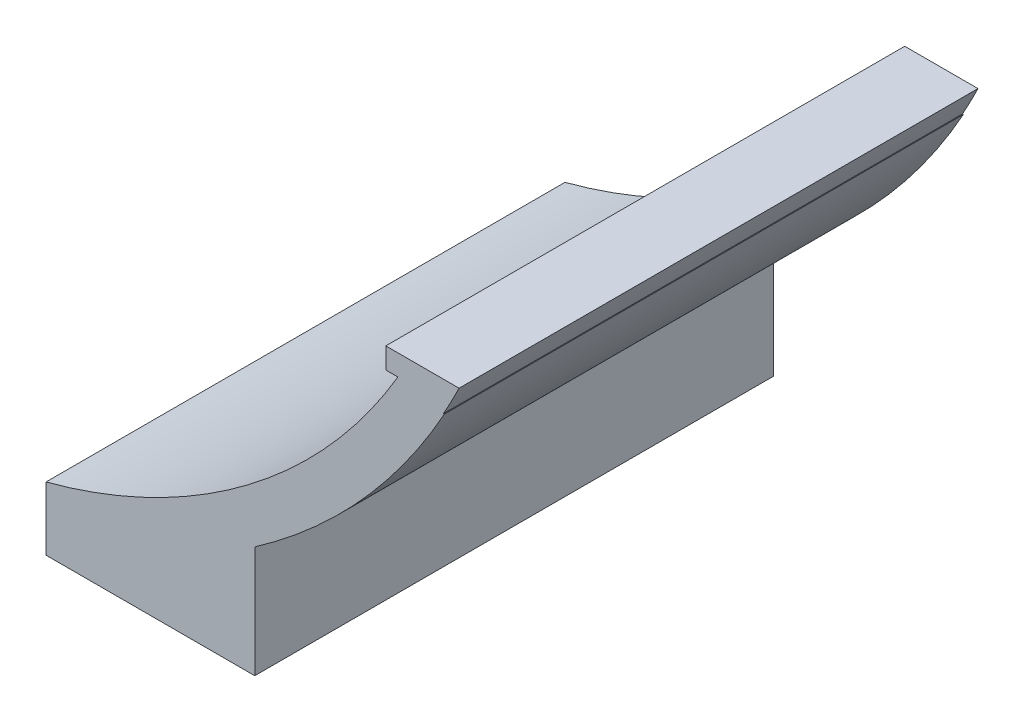
from build123d import *

# Parameters (mm, degrees)
SKETCH_1_R          = 210
SKETCH_1_R_2        = 203
EXTRUDE_2_DEPTH     = 174
EXTRUDE_START       = -174
EXTRUDE_4_DEPTH     = 174
CUT_EXTRUDE_1_DEPTH = 654
EXTRUDE_5_DEPTH     = 174
EXTRUDE_6_DEPTH     = 174
EXTRUDE_7_DEPTH     = 174
EXTRUDE_8_DEPTH     = 174
CUT_EXTRUDE_START   = -654
CUT_EXTRUDE_2_DEPTH = 654
SKETCH_10_W         = 20.487801248
SKETCH_10_H         = 174
CUT_EXTRUDE_3_DEPTH = 327
SKETCH_11_W         = 235.63772895
SKETCH_11_H         = 249.192111589
CUT_EXTRUDE_4_DEPTH = 238


with BuildPart() as part:
    # 草图1 → 凸台-拉伸2 (new body)
    with BuildSketch(Plane.XY):
        Circle(SKETCH_1_R)
        Circle(SKETCH_1_R_2, mode=Mode.SUBTRACT)
    extrude(amount=EXTRUDE_2_DEPTH)

    # 草图2 → 凸台-拉伸4 (add)
    with BuildSketch(Plane.XY.offset(174).offset(EXTRUDE_START)):
        with BuildLine():
            Line((-170.735431044, -102), (-173.735431044, -102))
            Line((-173.735431044, -102), (-175.513532242, -102))
            ThreePointArc((-175.513532242, -102), (-174.63092392, -103.50381834), (-173.735431044, -105))
            Line((-173.735431044, -105), (-170.735431044, -105))
            Line((-170.735431044, -105), (-170.735431044, -102))
        make_face()
        with BuildLine():
            ThreePointArc((173.735431044, -105), (174.63092392, -103.50381834), (175.513532242, -102))
            Line((175.513532242, -102), (173.735431044, -102))
            Line((173.735431044, -102), (170.735431044, -102))
            Line((170.735431044, -102), (170.735431044, -105))
            Line((170.735431044, -105), (173.735431044, -105))
        make_face()
    extrude(amount=EXTRUDE_4_DEPTH)

    # 草图3 → 切除-拉伸1 (cut)
    with BuildSketch(Plane.XY.offset(174)):
        Polygon((-170.735431044, -102), (238.333646515, -102), (254.334169784, 272.292523591), (-334.569415043, 221.85110305), (-306.830562533, -102), align=None)
    extrude(amount=-CUT_EXTRUDE_1_DEPTH, mode=Mode.SUBTRACT)

    # 草图5 → 凸台-拉伸5 (add)
    with BuildSketch(Plane.XY.offset(174).offset(EXTRUDE_START)):
        with BuildLine():
            Line((-120, -209.75), (-10.243900624, -209.75))
            ThreePointArc((-10.243900624, -209.75), (-67.755470707, -198.769203322), (-120, -172.336879396))
            Line((-120, -172.336879396), (-120, -209.75))
        make_face()
        with BuildLine():
            ThreePointArc((120, -172.336879396), (67.755470707, -198.769203322), (10.243900624, -209.75))
            Line((10.243900624, -209.75), (120, -209.75))
            Line((120, -209.75), (120, -172.336879396))
        make_face()
    extrude(amount=EXTRUDE_5_DEPTH)

    # 草图6 → 凸台-拉伸6 (add)
    with BuildSketch(Plane.XY.offset(174).offset(EXTRUDE_START)):
        with BuildLine():
            Line((-175.513532242, -102), (-166.195667814, -102))
            ThreePointArc((-166.195667814, -102), (0, -195), (166.195667814, -102))
            Line((166.195667814, -102), (175.513532242, -102))
            ThreePointArc((175.513532242, -102), (0, -203), (-175.513532242, -102))
        make_face()
    extrude(amount=EXTRUDE_6_DEPTH)

    # 草图7 → 凸台-拉伸7 (add)
    with BuildSketch(Plane.XY.offset(174).offset(EXTRUDE_START)):
        with BuildLine():
            Line((-166.933126535, -92), (-166.933126535, -95))
            Line((-166.933126535, -95), (-170.293863659, -95))
            ThreePointArc((-170.293863659, -95), (0, -195), (170.293863659, -95))
            Line((170.293863659, -95), (166.933126535, -95))
            Line((166.933126535, -95), (166.933126535, -92))
            Line((166.933126535, -92), (171.933126535, -92))
            Line((171.933126535, -92), (188.496850106, -92))
            ThreePointArc((188.496850106, -92), (0, -209.75), (-188.496850106, -92))
            Line((-188.496850106, -92), (-171.933126535, -92))
            Line((-171.933126535, -92), (-166.933126535, -92))
        make_face()
    extrude(amount=EXTRUDE_7_DEPTH)

    # 草图8 → 凸台-拉伸8 (add)
    with BuildSketch(Plane(origin=(0, 0, 0), x_dir=(-1, 0, 0), z_dir=(0, 0, -1))):
        with BuildLine():
            Line((166.933126535, -92), (163.933126535, -92))
            Line((163.933126535, -92), (163.933126535, -99))
            Line((163.933126535, -99), (168, -99))
            ThreePointArc((168, -99), (169.158755456, -97.006780447), (170.293863659, -95))
            Line((170.293863659, -95), (166.933126535, -95))
            Line((166.933126535, -95), (166.933126535, -92))
        make_face()
        with BuildLine():
            Line((-166.933126535, -95), (-170.293863659, -95))
            ThreePointArc((-170.293863659, -95), (-169.158755456, -97.006780447), (-168, -99))
            Line((-168, -99), (-163.933126535, -99))
            Line((-163.933126535, -99), (-163.933126535, -92))
            Line((-163.933126535, -92), (-166.933126535, -92))
            Line((-166.933126535, -92), (-166.933126535, -95))
        make_face()
    extrude(amount=-EXTRUDE_8_DEPTH)

    # 草图9 → 切除-拉伸2 (cut)
    with BuildSketch(Plane.XY.offset(174).offset(CUT_EXTRUDE_START)):
        with BuildLine():
            Line((0, -195), (0, -182.225251044))
            Line((0, -182.225251044), (-50, -182.225251044))
            Line((-50, -182.225251044), (-50, -188.48076825))
            ThreePointArc((-50, -188.48076825), (-25.211606368, -193.363323576), (0, -195))
        make_face()
        with BuildLine():
            Line((0, -209.75), (0, -195))
            ThreePointArc((0, -195), (-25.211606368, -193.363323576), (-50, -188.48076825))
            Line((-50, -188.48076825), (-50, -195))
            Line((-50, -195), (-50, -209.75))
            Line((-50, -209.75), (-10.243900624, -209.75))
            Line((-10.243900624, -209.75), (0, -209.75))
        make_face()
        with BuildLine():
            ThreePointArc((50, -188.48076825), (25.211606368, -193.363323576), (0, -195))
            Line((0, -195), (0, -209.75))
            Line((0, -209.75), (10.243900624, -209.75))
            Line((10.243900624, -209.75), (50, -209.75))
            Line((50, -209.75), (50, -195))
            Line((50, -195), (50, -188.48076825))
        make_face()
        with BuildLine():
            Line((50, -182.225251044), (0, -182.225251044))
            Line((0, -182.225251044), (0, -195))
            ThreePointArc((0, -195), (25.211606368, -193.363323576), (50, -188.48076825))
            Line((50, -188.48076825), (50, -182.225251044))
        make_face()
    extrude(amount=CUT_EXTRUDE_2_DEPTH, mode=Mode.SUBTRACT)


with BuildPart() as cut_extrude_2_piece_1:
    # of the separate pieces the step leaves, piece 1, a body of its own (cut_extrude_2_pieces)
    add(part.part.solids().sort_by_distance((-183.564702489, -102, 0))[0])

    # 草图11 → 切除-拉伸4 (cut)
    with BuildSketch(Plane(origin=(0, 0, 0), x_dir=(-1, 0, 0), z_dir=(0, 0, -1))):
        with Locations((136.586471206, -141.23053543)):
            Rectangle(SKETCH_11_W, SKETCH_11_H)
    extrude(amount=-CUT_EXTRUDE_4_DEPTH, mode=Mode.SUBTRACT)


with BuildPart() as cut_extrude_2_piece_2:
    # of the separate pieces the step leaves, piece 2, a body of its own (cut_extrude_2_pieces)
    add(part.part.solids().sort_by_distance((50, -188.48076825, 0))[0])


with BuildPart() as cut_extrude_2_piece_3:
    # of the separate pieces the step leaves, piece 3, a body of its own (cut_extrude_2_pieces)
    add(part.part.solids().sort_by_distance((10.243900624, -209.75, 0))[0])

    # 草图10 → 切除-拉伸3 (cut, symmetric)
    with BuildSketch(Plane(origin=(0, -209.75, 0), x_dir=(1, 0, 0), z_dir=(0, 1, 0))):
        with Locations((0, -87)):
            Rectangle(SKETCH_10_W, SKETCH_10_H)
    extrude(amount=CUT_EXTRUDE_3_DEPTH, both=True, mode=Mode.SUBTRACT)


solid = cut_extrude_2_piece_2.part
